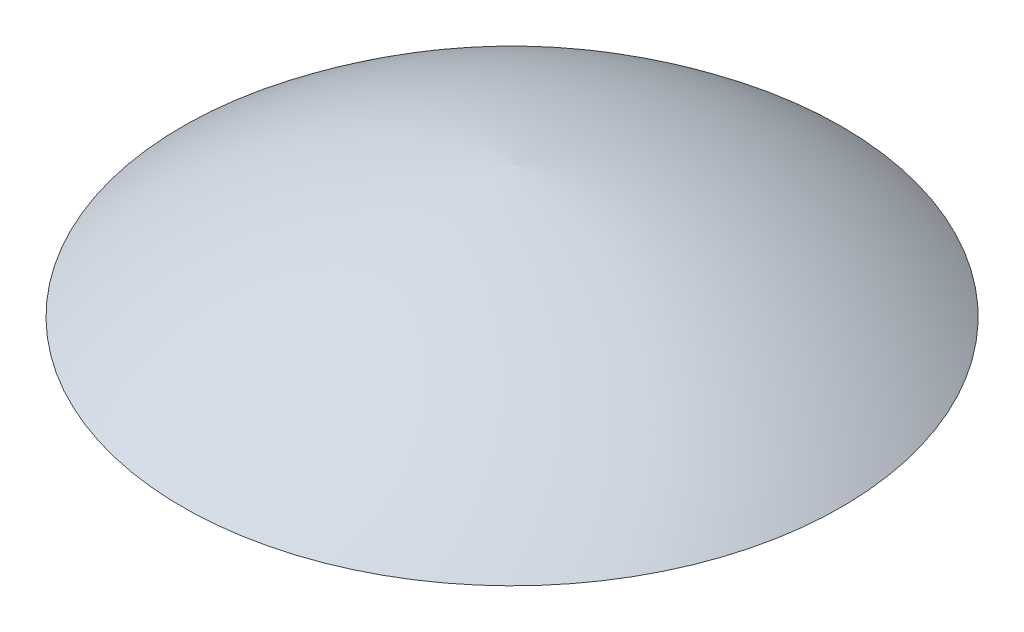
from build123d import *


with BuildPart() as part:
    # Sketch3 → Revolve5 (revolve)
    with BuildSketch(Plane(origin=(0, 0, 0), x_dir=(0, 0, -1), z_dir=(1, 0, 0))):
        with BuildLine():
            Line((0, 0), (32.5, 0))
            ThreePointArc((32.5, 0), (17.219085697, 8.922714242), (0, 13))
            Line((0, 13), (0, 0))
        make_face()
    revolve(axis=Axis((0, 0, 0), (0, 1, 0)))


solid = part.part
